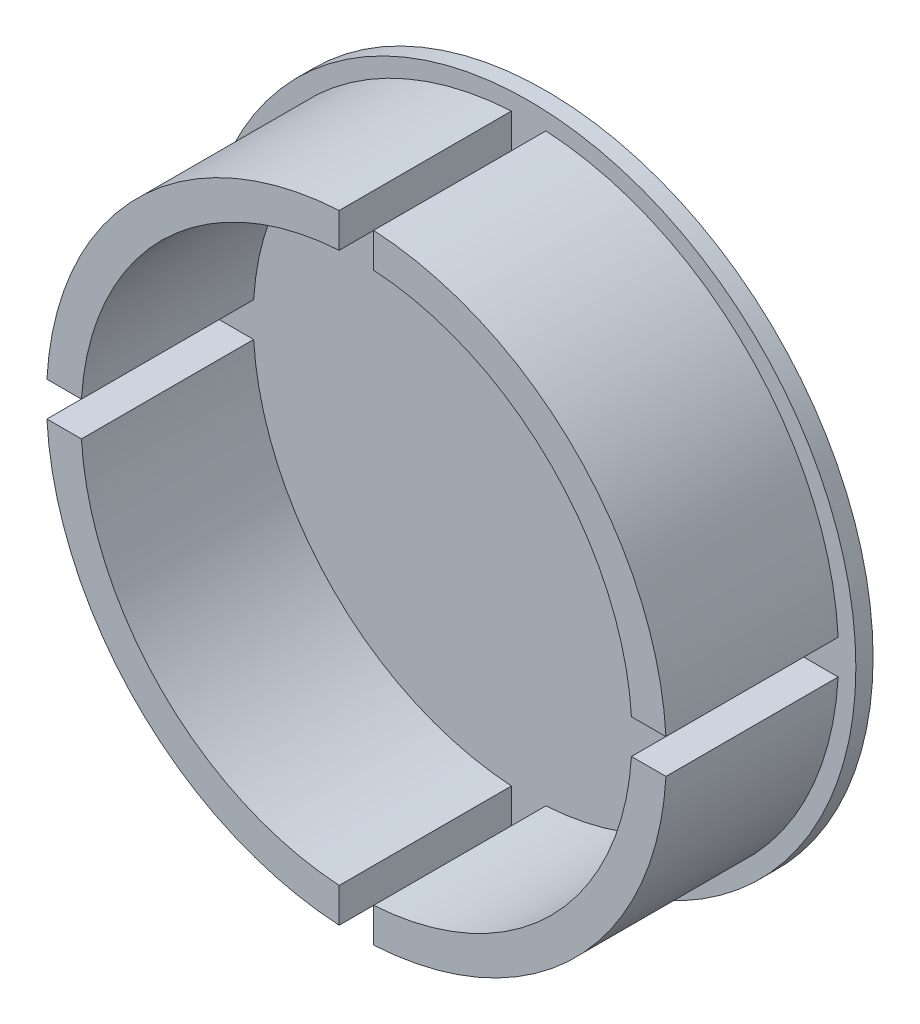
from build123d import *

# Parameters (mm, degrees)
SKETCH1_R           = 19
BOSS_EXTRUDE1_DEPTH = 1
SKETCH2_R           = 18
SKETCH2_R_2         = 16
BOSS_EXTRUDE2_DEPTH = 10
SKETCH3_W           = 3
SKETCH3_H           = 2
SKETCH3_W_2         = 2
SKETCH3_H_2         = 3
CUT_EXTRUDE1_DEPTH  = 10


with BuildPart() as part:
    # Sketch1 → Boss-Extrude1 (new body)
    with BuildSketch(Plane(origin=(0, 0, 0), x_dir=(0, 1, 0), z_dir=(0, 0, 1))):
        with Locations(Location((0, 0, 0), (0, 0, 270))):
            Circle(SKETCH1_R)
    extrude(amount=BOSS_EXTRUDE1_DEPTH)

    # Sketch2 → Boss-Extrude2 (add)
    with BuildSketch(Plane.XY.offset(1)):
        Circle(SKETCH2_R)
        Circle(SKETCH2_R_2, mode=Mode.SUBTRACT)
    extrude(amount=BOSS_EXTRUDE2_DEPTH)

    # Sketch3 → Cut-Extrude1 (cut)
    with BuildSketch(Plane.XY.offset(11)):
        with Locations((17, 0)):
            Rectangle(SKETCH3_W, SKETCH3_H)
        with Locations((0, 17)):
            Rectangle(SKETCH3_W_2, SKETCH3_H_2)
        with Locations((0, -17)):
            Rectangle(SKETCH3_W_2, SKETCH3_H_2)
        with Locations((-17, 0)):
            Rectangle(SKETCH3_W, SKETCH3_H)
    extrude(amount=-CUT_EXTRUDE1_DEPTH, mode=Mode.SUBTRACT)


solid = part.part
